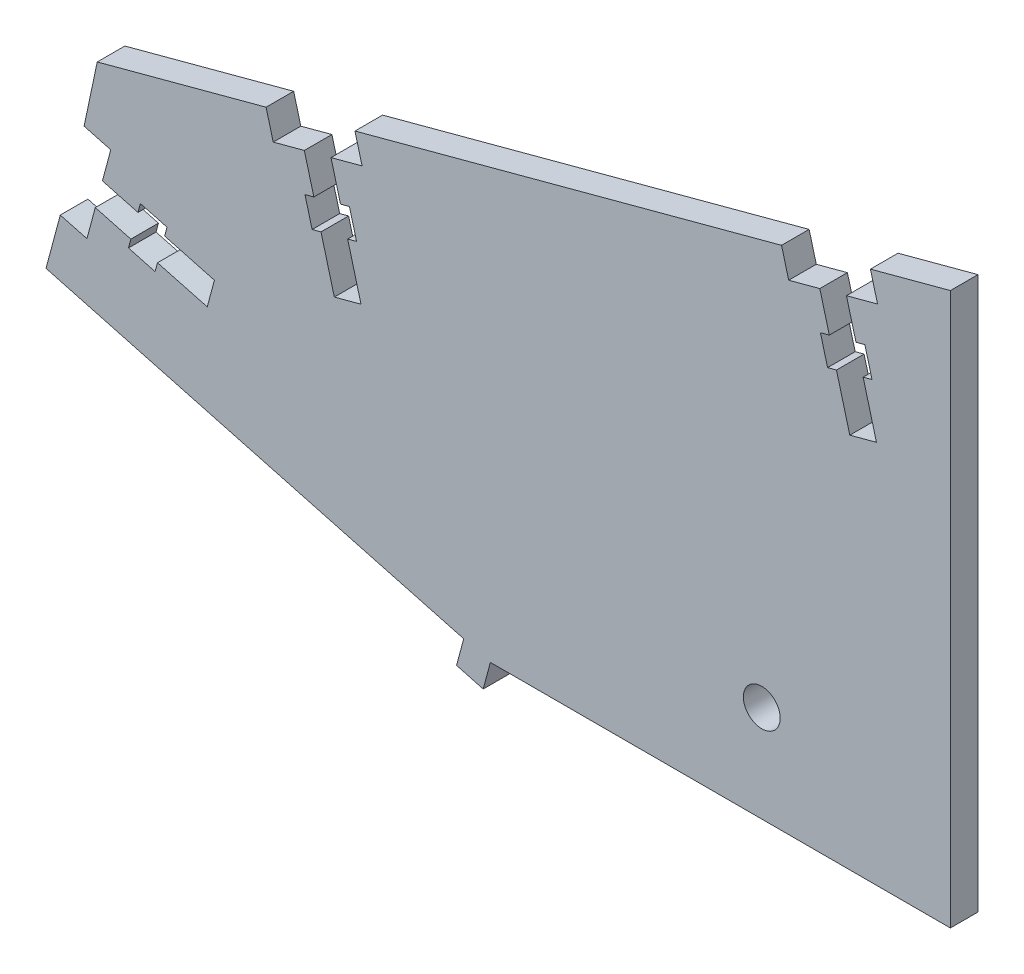
from build123d import *

# Parameters (mm, degrees)
SKETCH_1_R      = 2
EXTRUDE_1_DEPTH = 3


with BuildPart() as part:
    # 草图1 → 凸台-拉伸1 (new body)
    with BuildSketch(Plane.XY):
        Polygon((0, 0), (0, -60), (-50, -60), (-50.776457135, -62.897777479), (-53.674234614, -62.121320344), (-52.897777479, -59.223542865), (-98.296291314, -47.059047745), (-96.743377044, -41.263492787), (-93.845599565, -42.039949922), (-92.939732907, -38.65920953), (-89.076029602, -39.694485711), (-89.334848647, -40.660411537), (-86.437071168, -41.436868672), (-86.178252123, -40.470942846), (-80.769067496, -41.920329499), (-79.992610361, -39.02255202), (-85.401794988, -37.573165367), (-85.142975943, -36.607239541), (-88.040753422, -35.830782406), (-88.299572467, -36.796708232), (-92.163275772, -35.761432052), (-91.257409114, -32.38069166), (-94.155186593, -31.604234524), (-92.728879324, -24.84662833), (-74.376288624, -19.929066473), (-73.599831489, -22.826843952), (-70.219091097, -21.920977294), (-69.183814917, -25.784680599), (-70.149740743, -26.043499644), (-69.373283608, -28.941277123), (-68.407357781, -28.682458078), (-66.957971129, -34.091642705), (-64.06019365, -33.31518557), (-65.509580302, -27.906000943), (-64.543654476, -27.647181898), (-65.320111611, -24.749404419), (-66.286037438, -25.008223464), (-67.321313618, -21.144520159), (-63.940573226, -20.238653501), (-64.717030361, -17.340876022), (-18.352590699, -4.917561857), (-17.576133564, -7.815339336), (-14.195393172, -6.909472678), (-13.160116992, -10.773175983), (-14.126042818, -11.031995028), (-13.349585683, -13.929772507), (-12.383659856, -13.670953462), (-10.934273204, -19.080138089), (-8.036495725, -18.303680954), (-9.485882378, -12.894496327), (-8.519956551, -12.635677282), (-9.296413687, -9.737899803), (-10.262339513, -9.996718848), (-11.297615693, -6.133015543), (-7.916875301, -5.227148885), (-8.693332437, -2.329371406), align=None)
        with Locations((-20.5, -49.5)):
            Circle(SKETCH_1_R, mode=Mode.SUBTRACT)
    extrude(amount=EXTRUDE_1_DEPTH)


solid = part.part
